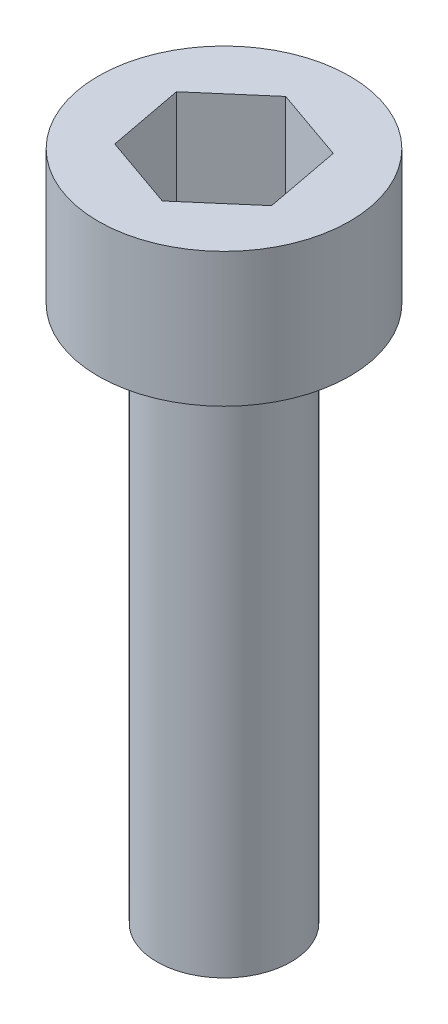
from build123d import *

# Parameters (mm, degrees)
CORTAR_EXTRUIR1_DEPTH = 2


with BuildPart() as part:
    # Croquis1 → Revolución1 (revolve)
    with BuildSketch(Plane.XY):
        Polygon((0, 0), (-1, 0), (-1, 8), (-1.875, 8), (-1.875, 10), (-0.515646635, 10), (-0.515646635, 8.322225361), (0, 8.322225361), align=None)
    revolve(axis=Axis((0, 8.322225361, 0), (0, -1, 0)))

    # Croquis2 → Cortar-Extruir1 (cut)
    with BuildSketch(Plane(origin=(0, 10, 0), x_dir=(1, 0, 0), z_dir=(0, 1, 0))):
        Polygon((0.875027781, 0.753431958), (-0.214977325, 1.134512267), (-1.090005106, 0.381080309), (-0.875027781, -0.753431958), (0.214977325, -1.134512267), (1.090005106, -0.381080309), align=None)
    extrude(amount=-CORTAR_EXTRUIR1_DEPTH, mode=Mode.SUBTRACT)


with BuildPart() as cortar_extruir1_piece_1:
    # of the separate pieces the step leaves, piece 1, a body of its own (cortar_extruir1_pieces)
    add(part.part.solids().sort_by_distance((-1, 0, 0))[0])


with BuildPart() as cortar_extruir1_piece_2:
    # of the separate pieces the step leaves, piece 2, a body of its own (cortar_extruir1_pieces)
    add(part.part.solids().sort_by_distance((-1.875, 8, 0))[0])


solid = Compound([cortar_extruir1_piece_1.part, cortar_extruir1_piece_2.part])
